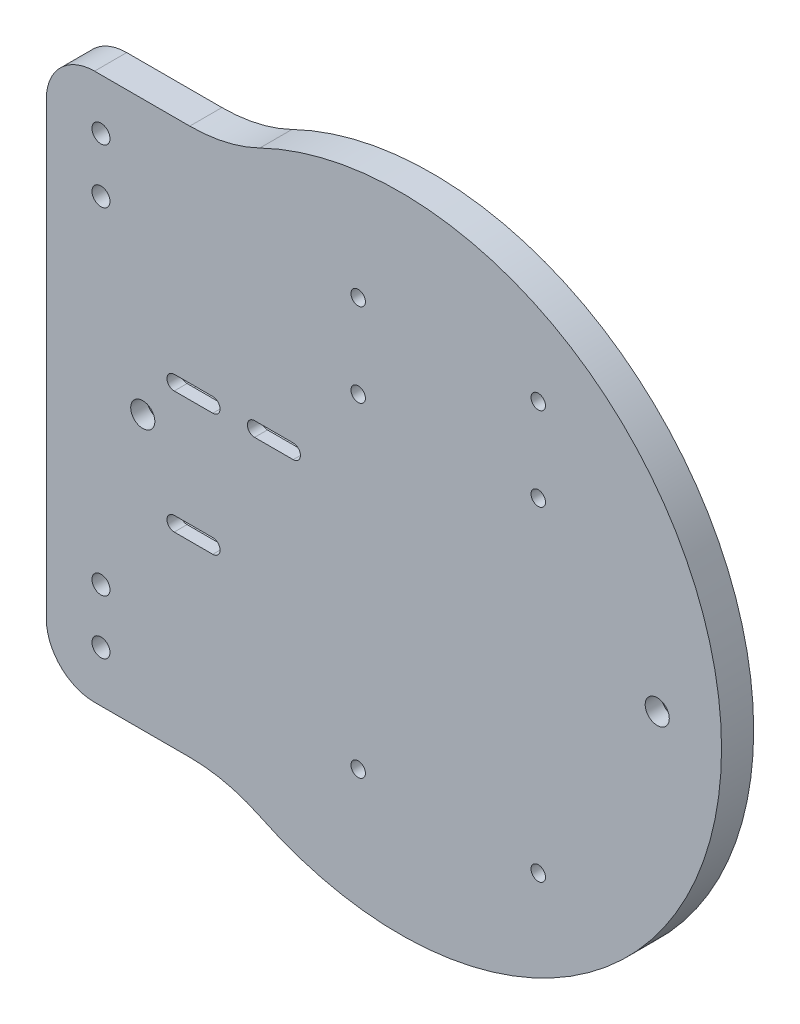
from build123d import *

# Parameters (mm, degrees)
SALIENTE_EXTRUIR2_DEPTH                              = 10
REDONDEO3_R                                          = 15
REDONDEO5_R                                          = 50
CROQUIS4_R                                           = 2.8
CROQUIS4_R_2                                         = 2.25
CORTAR_EXTRUIR1_DEPTH                                = 149.996644258
REFRENTADO_PARA_TORNILLO_CON_CABEZA_TRON_D           = 4.5
REFRENTADO_PARA_TORNILLO_CON_CABEZA_TRON_CBORE_D     = 7.5
REFRENTADO_PARA_TORNILLO_CON_CABEZA_TRON_CBORE_DEPTH = 5
CORTAR_EXTRUIR2_DEPTH                                = 6


with BuildPart() as part:
    # Croquis2 → Saliente-Extruir2 (new body)
    with BuildSketch(Plane(origin=(0, 0, 0), x_dir=(0, 1, 0), z_dir=(0, 0, 1))):
        with BuildLine():
            Line((-85, 52.678268764), (-85, 110))
            Line((-85, 110), (85, 110))
            Line((85, 110), (85, 52.678268764))
            ThreePointArc((85, 52.678268764), (0, -100), (-85, 52.678268764))
        make_face()
    extrude(amount=SALIENTE_EXTRUIR2_DEPTH)

    # Redondeo3
    redondeo3_edges = [part.edges().sort_by_distance(p)[0] for p in [
        (-110, 85, 5),
        (-110, -85, 5),
    ]]
    fillet(redondeo3_edges, radius=REDONDEO3_R)

    # Redondeo5
    redondeo5_edges = [part.edges().sort_by_distance(p)[0] for p in [
        (-52.678268764, 85, 5),
        (-52.678268764, -85, 5),
    ]]
    fillet(redondeo5_edges, radius=REDONDEO5_R)

    # Croquis4 → Cortar-Extruir1 (cut, through all)
    with BuildSketch(Plane.XY.offset(10)):
        with Locations((-93, 69.2)):
            Circle(CROQUIS4_R)
        with Locations((-93, 52.279001067)):
            Circle(CROQUIS4_R)
        with Locations((-93, -52.279001068)):
            Circle(CROQUIS4_R)
        with Locations((-93, -69.2)):
            Circle(CROQUIS4_R)
        with Locations((-13, 39)):
            Circle(CROQUIS4_R_2)
        with Locations((43, 39)):
            Circle(CROQUIS4_R_2)
        with Locations((-13, 65)):
            Circle(CROQUIS4_R_2)
        with Locations((43, 65)):
            Circle(CROQUIS4_R_2)
        with Locations((-13, -62)):
            Circle(CROQUIS4_R_2)
        with Locations((43, -62)):
            Circle(CROQUIS4_R_2)
        with BuildLine():
            Line((-58.219532094, 11.25), (-70.219532094, 11.25))
            ThreePointArc((-70.219532094, 11.25), (-72.469532094, 13.5), (-70.219532094, 15.75))
            Line((-70.219532094, 15.75), (-58.219532094, 15.75))
            ThreePointArc((-58.219532094, 15.75), (-55.969532094, 13.5), (-58.219532094, 11.25))
        make_face()
        with BuildLine():
            Line((-33.219532094, 11.25), (-45.219532094, 11.25))
            ThreePointArc((-45.219532094, 11.25), (-47.469532094, 13.5), (-45.219532094, 15.75))
            Line((-45.219532094, 15.75), (-33.219532094, 15.75))
            ThreePointArc((-33.219532094, 15.75), (-30.969532094, 13.5), (-33.219532094, 11.25))
        make_face()
        with BuildLine():
            Line((-58.219532094, -26.75), (-70.219532094, -26.75))
            ThreePointArc((-70.219532094, -26.75), (-72.469532094, -24.5), (-70.219532094, -22.25))
            Line((-70.219532094, -22.25), (-58.219532094, -22.25))
            ThreePointArc((-58.219532094, -22.25), (-55.969532094, -24.5), (-58.219532094, -26.75))
        make_face()
    extrude(amount=-CORTAR_EXTRUIR1_DEPTH, mode=Mode.SUBTRACT)

    # Refrentado para tornillo con cabeza troncocónica de M41 (through all)
    with Locations(Plane.XY.offset(10)):
        with Locations((-80, 0), (80, 0)):
            CounterBoreHole(REFRENTADO_PARA_TORNILLO_CON_CABEZA_TRON_D / 2, REFRENTADO_PARA_TORNILLO_CON_CABEZA_TRON_CBORE_D / 2, REFRENTADO_PARA_TORNILLO_CON_CABEZA_TRON_CBORE_DEPTH)

    # Croquis7 → Cortar-Extruir2 (cut)
    with BuildSketch(Plane(origin=(0, 0, 0), x_dir=(1, 0, 0), z_dir=(0, 0, -1))):
        with BuildLine():
            Line((-70.219532094, 29), (-58.219532094, 29))
            ThreePointArc((-58.219532094, 29), (-53.719532094, 24.5), (-58.219532094, 20))
            Line((-58.219532094, 20), (-70.219532094, 20))
            ThreePointArc((-70.219532094, 20), (-74.719532094, 24.5), (-70.219532094, 29))
        make_face()
        with BuildLine():
            Line((-70.219532094, -9), (-58.219532094, -9))
            ThreePointArc((-58.219532094, -9), (-53.719532094, -13.5), (-58.219532094, -18))
            Line((-58.219532094, -18), (-70.219532094, -18))
            ThreePointArc((-70.219532094, -18), (-74.719532094, -13.5), (-70.219532094, -9))
        make_face()
        with BuildLine():
            Line((-45.219532094, -9), (-33.219532094, -9))
            ThreePointArc((-33.219532094, -9), (-28.719532094, -13.5), (-33.219532094, -18))
            Line((-33.219532094, -18), (-45.219532094, -18))
            ThreePointArc((-45.219532094, -18), (-49.719532094, -13.5), (-45.219532094, -9))
        make_face()
    extrude(amount=-CORTAR_EXTRUIR2_DEPTH, mode=Mode.SUBTRACT)


solid = part.part
